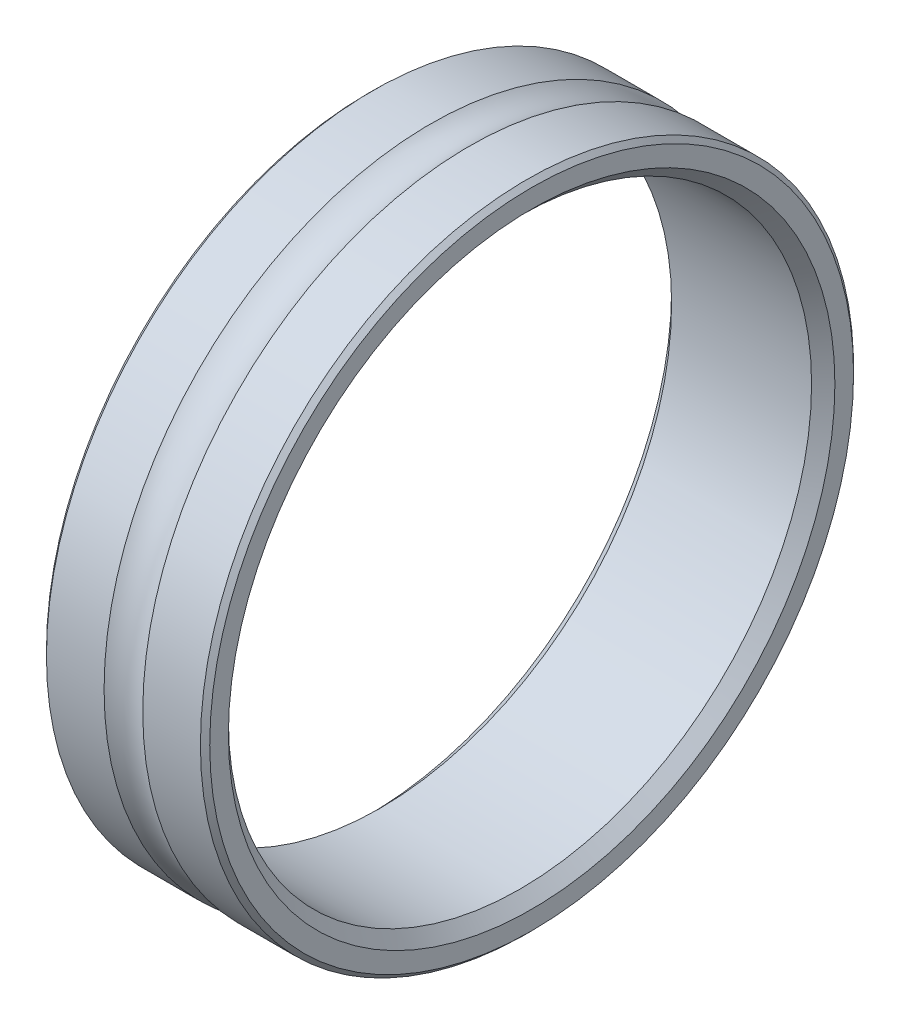
from build123d import *

# Parameters (mm, degrees)
CHAMFER_1_SIZE = 0.5
CHAMFER_2_SIZE = 0.2


with BuildPart() as part:
    # Эскиз1 → Повернуть1 (revolve)
    with BuildSketch(Plane.XY, mode=Mode.PRIVATE) as revolve_1_sk:
        with BuildLine():
            Line((0.829156198, 14), (3.5, 14))
            Line((3.5, 14), (3.5, 12.5))
            Line((3.5, 12.5), (-3.5, 12.5))
            Line((-3.5, 12.5), (-3.5, 14))
            Line((-3.5, 14), (-0.829156198, 14))
            ThreePointArc((-0.829156198, 14), (0, 13.75), (0.829156198, 14))
        make_face()
    revolve(revolve_1_sk.sketch.rotate(Axis((0, 0, 0), (1, 0, 0)), 90), axis=Axis((0, 0, 0), (1, 0, 0)))

    # Фаска1
    chamfer_1_edges = [part.edges().sort_by_distance(p)[0] for p in [
        (3.5, 0, -12.5),
        (-3.5, 0, -12.5),
    ]]
    chamfer(chamfer_1_edges, length=CHAMFER_1_SIZE)

    # Фаска2
    chamfer_2_edges = [part.edges().sort_by_distance(p)[0] for p in [
        (-3.5, 0, -14),
        (3.5, 0, -14),
    ]]
    chamfer(chamfer_2_edges, length=CHAMFER_2_SIZE)


solid = part.part
